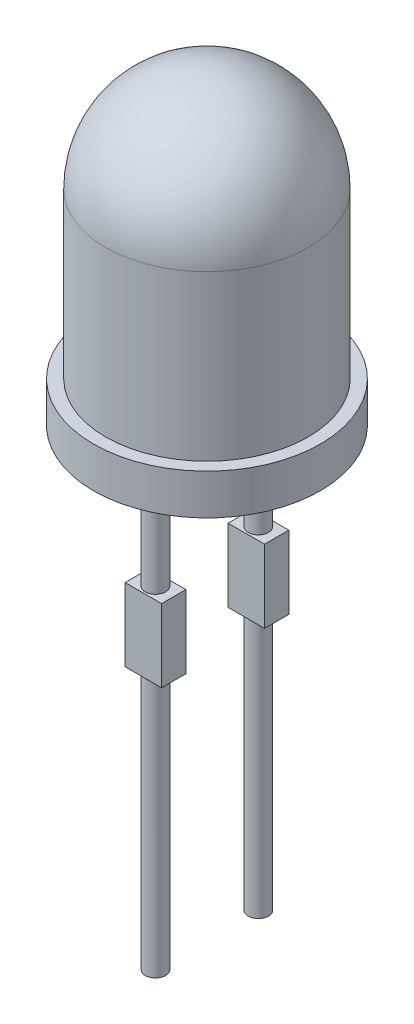
from build123d import *

# Parameters (mm, degrees)
SKETCH2_R             = 0.25
BOSS_EXTRUDE1_DEPTH   = 11
BOSS_EXTRUDE1_2_DEPTH = 11
SKETCH3_W             = 0.6
SKETCH3_H             = 1.8
BOSS_EXTRUDE2_DEPTH   = 0.45


with BuildPart() as part:
    # Sketch1 → Revolve1 (revolve)
    with BuildSketch(Plane(origin=(0, 0, 0), x_dir=(0, 0, -1), z_dir=(1, 0, 0))):
        with BuildLine():
            Line((-2.5, 2.025), (-2.5, -2.025))
            Line((-2.5, -2.025), (-2.8, -2.025))
            Line((-2.8, -2.025), (-2.8, -3.025))
            Line((-2.8, -3.025), (0, -3.025))
            Line((0, -3.025), (0, 4.525))
            ThreePointArc((0, 4.525), (-1.767766953, 3.792766953), (-2.5, 2.025))
        make_face()
    revolve(axis=Axis((0, 4.525, 0), (0, -1, 0)))


with BuildPart() as body_2:
    # Sketch2 → Boss-Extrude1 (new body)
    with BuildSketch(Plane.XZ.offset(3.025)):
        with Locations(Location((0, 1.27, 0), (0, 0, 270))):
            Circle(SKETCH2_R)
    extrude(amount=BOSS_EXTRUDE1_DEPTH)



with BuildPart() as body_3:
    # Sketch2 → Boss-Extrude1 2 (new body)
    with BuildSketch(Plane.XZ.offset(3.025)):
        with Locations(Location((0, -1.27, 0), (0, 0, 90))):
            Circle(SKETCH2_R)
    extrude(amount=BOSS_EXTRUDE1_2_DEPTH)


with BuildPart() as body_2_1:
    add(body_2.part)

    add(body_3.part)  # Boss-Extrude2 merges body 3
    # Sketch3 → Boss-Extrude2 (add, symmetric)
    with BuildSketch(Plane(origin=(0, 0, 0), x_dir=(0, 0, -1), z_dir=(1, 0, 0))):
        with Locations((1.27, -6.725)):
            Rectangle(SKETCH3_W, SKETCH3_H)
        with Locations((-1.27, -6.725)):
            Rectangle(SKETCH3_W, SKETCH3_H)
    extrude(amount=BOSS_EXTRUDE2_DEPTH, both=True)


solid = Compound([part.part, body_2_1.part])
